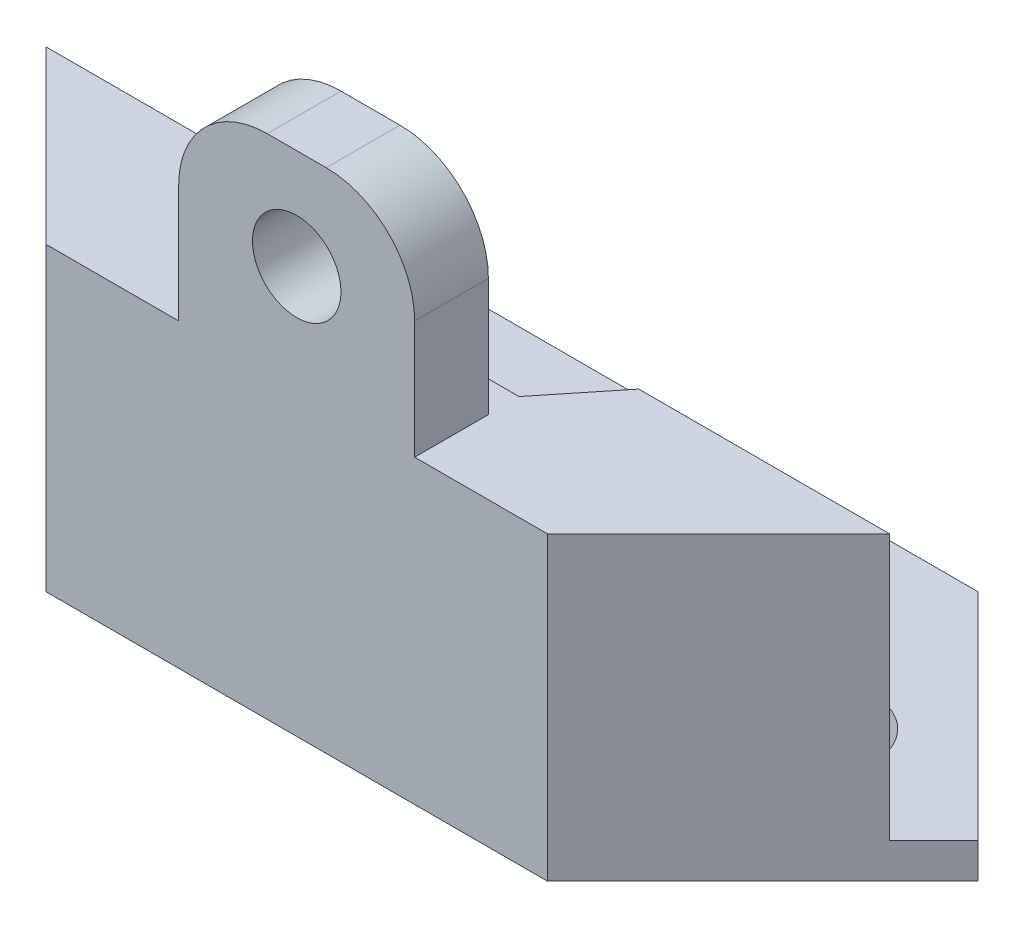
from build123d import *

# Parameters (mm, degrees)
ESBO_O1_W                = 17
ESBO_O1_H                = 14.6
RESSALTO_EXTRUS_O1_DEPTH = 1.2
ESBO_O2_R                = 2
ESBO_O2_R_2              = 2.054882152
CORTE_EXTRUS_O3_DEPTH    = 18.446203025
RESSALTO_EXTRUS_O4_DEPTH = 9
ESBO_O8_R                = 1.15
CORTE_EXTRUS_O4_DEPTH    = 3
ESBO_O10_W               = 8
ESBO_O10_H               = 2.5
RESSALTO_EXTRUS_O5_DEPTH = 7
ESBO_O11_R               = 1.5
CORTE_EXTRUS_O5_DEPTH    = 10
CORTE_EXTRUS_O8_DEPTH    = 9
FILETE1_R                = 3
FILETE2_R                = 3


with BuildPart() as part:
    # Esboço1 → Ressalto-extrusão1 (new body)
    with BuildSketch(Plane(origin=(0, 0, 0), x_dir=(1, 0, 0), z_dir=(0, 1, 0))):
        Rectangle(ESBO_O1_W, ESBO_O1_H)
        Polygon((-15.8, 0), (-8.5, 7.3), (-8.5, -7.3), align=None)
        Polygon((8.5, -7.3), (15.8, 0), (8.5, 7.3), align=None)
    extrude(amount=RESSALTO_EXTRUS_O1_DEPTH)

    # Esboço2 → Corte-extrusão3 (cut, through all)
    with BuildSketch(Plane(origin=(0, 1.2, 0), x_dir=(1, 0, 0), z_dir=(0, 1, 0))):
        with Locations(Location((-9.75, 0.5, 0), (0, 0, 270))):
            Circle(ESBO_O2_R)
        with Locations(Location((0, 3.5, 0), (0, 0, 270))):
            Circle(ESBO_O2_R_2)
        with Locations(Location((9.75, 0.5, 0), (0, 0, 270))):
            Circle(ESBO_O2_R)
    extrude(amount=-CORTE_EXTRUS_O3_DEPTH, mode=Mode.SUBTRACT)

    # Esboço6 → Ressalto-extrusão4 (add)
    with BuildSketch(Plane(origin=(0, 1.2, 0), x_dir=(1, 0, 0), z_dir=(0, 1, 0))):
        Polygon((-14.3, -1.5), (14.3, -1.5), (8.5, -7.3), (-8.5, -7.3), align=None)
    extrude(amount=RESSALTO_EXTRUS_O4_DEPTH)

    # Esboço8 → Corte-extrusão4 (cut)
    with BuildSketch(Plane(origin=(0, 0, 1.5), x_dir=(-1, 0, 0), z_dir=(0, 0, -1))):
        with Locations((-9.8, 6.7)):
            Circle(ESBO_O8_R)
        with Locations((9.75, 6.7)):
            Circle(ESBO_O8_R)
    extrude(amount=-CORTE_EXTRUS_O4_DEPTH, mode=Mode.SUBTRACT)

    # Esboço10 → Ressalto-extrusão5 (add)
    with BuildSketch(Plane(origin=(0, 10.2, 0), x_dir=(1, 0, 0), z_dir=(0, 1, 0))):
        with Locations((0, -6.05)):
            Rectangle(ESBO_O10_W, ESBO_O10_H)
    extrude(amount=RESSALTO_EXTRUS_O5_DEPTH)

    # Esboço11 → Corte-extrusão5 (cut)
    with BuildSketch(Plane(origin=(0, 0, 4.8), x_dir=(-1, 0, 0), z_dir=(0, 0, -1))):
        with Locations((0, 13.8)):
            Circle(ESBO_O11_R)
    extrude(amount=-CORTE_EXTRUS_O5_DEPTH, mode=Mode.SUBTRACT)

    # Esboço12 → Corte-extrusão8 (cut)
    with BuildSketch(Plane(origin=(0, 10.2, 0), x_dir=(1, 0, 0), z_dir=(0, 1, 0))):
        Polygon((-3.957764838, -3.75), (-5.8, -1.5), (5.8, -1.5), (3.98902582, -3.75), align=None)
    extrude(amount=-CORTE_EXTRUS_O8_DEPTH, mode=Mode.SUBTRACT)

    # Filete1
    filete1_edges = [part.edges().sort_by_distance(p)[0] for p in [
        (4, 17.2, 6.05),
    ]]
    fillet(filete1_edges, radius=FILETE1_R)

    # Filete2
    filete2_edges = [part.edges().sort_by_distance(p)[0] for p in [
        (-4, 17.2, 6.05),
    ]]
    fillet(filete2_edges, radius=FILETE2_R)


solid = part.part
